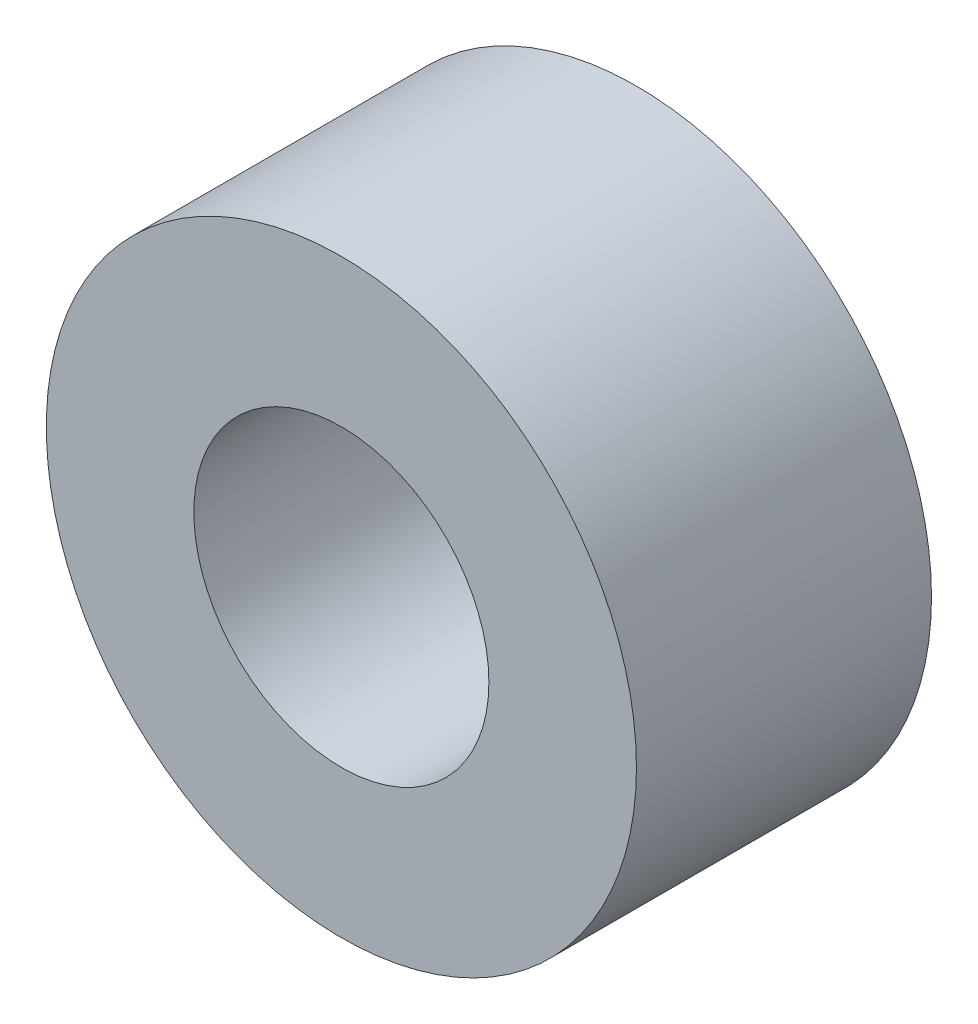
from build123d import *

# Parameters (mm, degrees)
SKETCH_1_R      = 2
SKETCH_1_R_2    = 1
EXTRUDE_1_DEPTH = 2


with BuildPart() as part:
    # 草图1 → 凸台-拉伸1 (new body)
    with BuildSketch(Plane.XY):
        with Locations((-5.058981819, 32.481381269)):
            Circle(SKETCH_1_R)
        with Locations((-5.058981819, 32.481381269)):
            Circle(SKETCH_1_R_2, mode=Mode.SUBTRACT)
    extrude(amount=EXTRUDE_1_DEPTH)


solid = part.part
